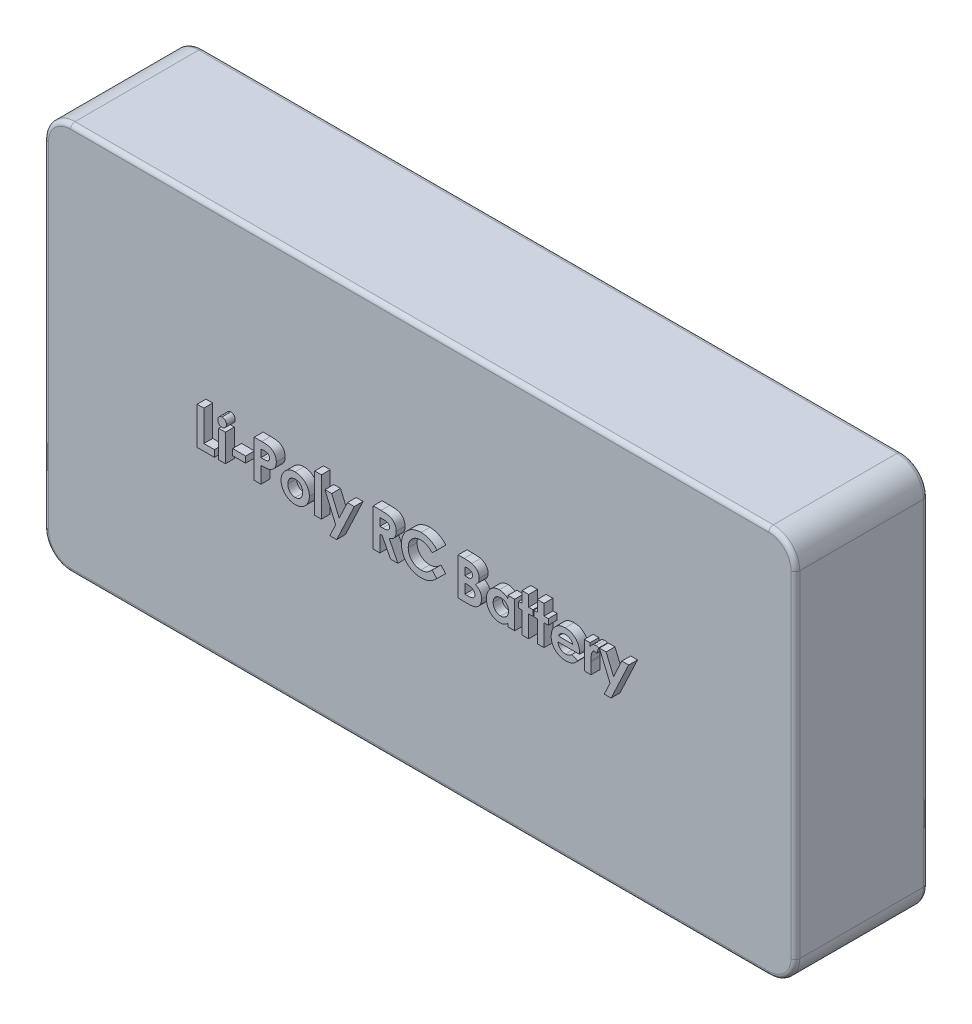
from build123d import *

# Parameters (mm, degrees)
SKETCH1_W           = 85
SKETCH1_H           = 44
BOSS_EXTRUDE1_DEPTH = 15
FILLET1_R           = 3
FILLET2_R           = 0.5
SKETCH2_W           = 0.75982906
SKETCH2_H           = 3.093589743
SKETCH2_W_2         = 1.465384616
SKETCH2_H_2         = 0.705555555
SKETCH2_H_3         = 4.341880342
BOSS_EXTRUDE2_DEPTH = 1


with BuildPart() as part:
    # Sketch1 → Boss-Extrude1 (new body)
    with BuildSketch(Plane.XY):
        with Locations((7.382629108, -9.695618153)):
            Rectangle(SKETCH1_W, SKETCH1_H)
    extrude(amount=BOSS_EXTRUDE1_DEPTH)

    # Fillet1
    fillet1_edges = [part.edges().sort_by_distance(p)[0] for p in [
        (-35.117370892, 12.304381847, 7.5),
        (49.882629108, 12.304381847, 7.5),
        (49.882629108, -31.695618153, 7.5),
        (-35.117370892, -31.695618153, 7.5),
    ]]
    fillet(fillet1_edges, radius=FILLET1_R)

    # Fillet2
    fillet2_edges = [part.edges().sort_by_distance(p)[0] for p in [
        (7.382629108, 12.304381847, 0),
        (7.382629108, 12.304381847, 15),
        (-35.117370892, -9.695618153, 0),
        (49.882629108, -9.695618153, 0),
        (7.382629108, -31.695618153, 0),
        (-34.238691236, 11.42570219, 0),
        (-34.238691236, -30.816938497, 0),
        (49.003949452, -30.816938497, 0),
        (49.003949452, 11.42570219, 0),
        (49.882629108, -9.695618153, 15),
        (-35.117370892, -9.695618153, 15),
        (7.382629108, -31.695618153, 15),
        (-34.238691236, 11.42570219, 15),
        (-34.238691236, -30.816938497, 15),
        (49.003949452, -30.816938497, 15),
        (49.003949452, 11.42570219, 15),
    ]]
    fillet(fillet2_edges, radius=FILLET2_R)

    # Sketch2 → Boss-Extrude2 (add)
    # profile 1 of 17: a face of its own
    with BuildSketch(Plane.XY.offset(15)):
        Polygon((-16.796217046, -6.973647825), (-16.036387986, -6.973647825), (-16.036387986, -10.447152098), (-14.842370892, -10.447152098), (-14.842370892, -11.206981158), (-16.796217046, -11.206981158), align=None)
    # profile 2 of 17: a face of its own
    with BuildSketch(Plane.XY.offset(15)):
        with BuildLine():
            add(Edge.make_bspline(
                [(-13.975690871, -6.810827312), (-13.942942243, -6.812434084), (-13.878637159, -6.815589135), (-13.786511375, -6.846343862), (-13.701958575, -6.894612487), (-13.627211556, -6.960838192), (-13.565043975, -7.039923796), (-13.517545634, -7.128465388), (-13.491086287, -7.22656662), (-13.487411475, -7.294333925), (-13.485533285, -7.328969673)],
                knots=[0, 0, 0, 0, 0.989868614, 1.943702388, 2.910836514, 3.924849579, 4.949916355, 5.946401046, 6.950409252, 8, 8, 8, 8], degree=3))
            add(Edge.make_bspline(
                [(-13.485533285, -7.328969673), (-13.487344277, -7.363350175), (-13.490873079, -7.43034222), (-13.518154612, -7.527111683), (-13.563746535, -7.61561027), (-13.626417634, -7.693521306), (-13.700354298, -7.758680406), (-13.783059554, -7.807825319), (-13.874302506, -7.836869168), (-13.93760977, -7.840287964), (-13.969754706, -7.842023893)],
                knots=[0, 0, 0, 0, 1.05296456, 2.051751585, 3.055639087, 4.085634717, 5.099016424, 6.062201612, 7.016062274, 8, 8, 8, 8], degree=3))
            add(Edge.make_bspline(
                [(-13.969754706, -7.842023893), (-14.002789202, -7.840422866), (-14.067653738, -7.837279185), (-14.160535143, -7.806452498), (-14.246215661, -7.75856402), (-14.320638428, -7.690985221), (-14.383517967, -7.611337654), (-14.428941562, -7.520734738), (-14.457355144, -7.421962691), (-14.460727811, -7.353191706), (-14.462456362, -7.317945368)],
                knots=[0, 0, 0, 0, 0.989065327, 1.942068821, 2.907541208, 3.917690034, 4.939857478, 5.938239964, 6.943311734, 8, 8, 8, 8], degree=3))
            add(Edge.make_bspline(
                [(-14.462456362, -7.317945368), (-14.460575226, -7.284148667), (-14.456880005, -7.217759928), (-14.430262163, -7.121839774), (-14.383852958, -7.034786705), (-14.322133176, -6.957148837), (-14.248042687, -6.892158491), (-14.163540646, -6.845355815), (-14.072034871, -6.815871345), (-14.008137137, -6.812526017), (-13.975690871, -6.810827312)],
                knots=[0, 0, 0, 0, 1.038616768, 2.040212704, 3.031499824, 4.052181184, 5.074969369, 6.039807101, 7.004644834, 8, 8, 8, 8], degree=3))
        make_face()
    # profile 3 of 17: a face of its own
    with BuildSketch(Plane.XY.offset(15)):
        with Locations((-13.973994824, -9.660186287)):
            Rectangle(SKETCH2_W, SKETCH2_H)
    # profile 4 of 17: a face of its own
    with BuildSketch(Plane.XY.offset(15)):
        with Locations((-12.047285422, -9.660186287)):
            Rectangle(SKETCH2_W_2, SKETCH2_H_2)
    # profile 5 of 17: a face of its own
    with BuildSketch(Plane.XY.offset(15)):
        with BuildLine():
            Line((-10.337670037, -6.973647825), (-9.489646533, -6.973647825))
            add(Edge.make_bspline(
                [(-9.489646533, -6.973647825), (-9.434237777, -6.973895846), (-9.327342673, -6.974374332), (-9.173191139, -6.980176602), (-9.0309788, -6.990574623), (-8.900738331, -7.003424933), (-8.782523283, -7.021440567), (-8.676185615, -7.042094081), (-8.58170326, -7.067256073), (-8.498010789, -7.097123008), (-8.422899499, -7.132334958), (-8.351819993, -7.169838198), (-8.286378676, -7.214596992), (-8.223272527, -7.261787427), (-8.166109432, -7.315917588), (-8.111323217, -7.373385035), (-8.061234227, -7.436468877), (-8.015610367, -7.504405503), (-7.974222497, -7.575939735), (-7.938063284, -7.651199453), (-7.908732956, -7.73030375), (-7.884128458, -7.812740909), (-7.864365885, -7.898507339), (-7.851211287, -7.988130509), (-7.842276023, -8.080984639), (-7.841487609, -8.144181218), (-7.841088841, -8.176145154)],
                knots=[0, 0, 0, 0, 1.698747864, 3.27724071, 4.728299578, 6.070144658, 7.288476769, 8.393259625, 9.389771311, 10.283485332, 11.113357557, 11.931608583, 12.74405601, 13.541433047, 14.344816069, 15.154114104, 15.974336324, 16.810834471, 17.661136416, 18.50621059, 19.367396281, 20.244825668, 21.142564693, 22.063065223, 23.020325768, 24, 24, 24, 24], degree=3))
            add(Edge.make_bspline(
                [(-7.841088841, -8.176145154), (-7.841665809, -8.211506096), (-7.842799622, -8.280994692), (-7.853914646, -8.382856448), (-7.872902617, -8.47997241), (-7.897718903, -8.573161574), (-7.932323449, -8.660890773), (-7.971857518, -8.74525325), (-8.020496962, -8.823883743), (-8.076075303, -8.897765822), (-8.136773192, -8.967500185), (-8.204031594, -9.031073384), (-8.276568536, -9.088918795), (-8.353964126, -9.141642642), (-8.436508931, -9.189138569), (-8.524143392, -9.231851326), (-8.617465925, -9.268414826), (-8.682452929, -9.287537241), (-8.715401074, -9.297232227)],
                knots=[0, 0, 0, 0, 1.102006807, 2.165578795, 3.188629044, 4.184801286, 5.166646146, 6.124351954, 7.085497154, 8.042432466, 9.003981491, 9.963833307, 10.922997304, 11.89326795, 12.880200226, 13.889073926, 14.929769137, 16, 16, 16, 16], degree=3))
            add(Edge.make_bspline(
                [(-8.715401074, -9.297232227), (-8.737102617, -9.302631606), (-8.784115148, -9.3143284), (-8.861907975, -9.326203581), (-8.95155604, -9.337122081), (-9.053349234, -9.346505209), (-9.167346243, -9.35288355), (-9.293436688, -9.35786475), (-9.431677712, -9.361486598), (-9.527805053, -9.361615117), (-9.577840977, -9.361682013)],
                knots=[0, 0, 0, 0, 0.618981996, 1.340914327, 2.176866532, 3.120127938, 4.170906482, 5.338178032, 6.614476169, 8, 8, 8, 8], degree=3))
            Line((-9.577840977, -9.361682013), (-9.577840977, -11.206981158))
            Line((-9.577840977, -11.206981158), (-10.337670037, -11.206981158))
            Line((-10.337670037, -11.206981158), (-10.337670037, -6.973647825))
        make_face()
        with BuildLine():
            Line((-9.577840977, -8.601852953), (-9.309017527, -8.601852953))
            add(Edge.make_bspline(
                [(-9.309017527, -8.601852953), (-9.260100856, -8.601542784), (-9.170093454, -8.600972067), (-9.047175129, -8.59271917), (-8.948395598, -8.58011533), (-8.870357934, -8.562038509), (-8.808739807, -8.534604539), (-8.75559803, -8.502868602), (-8.710016971, -8.462739381), (-8.670550483, -8.41688488), (-8.638998216, -8.364195759), (-8.617118361, -8.30552996), (-8.602905638, -8.242120113), (-8.601592961, -8.197991056), (-8.600917901, -8.175297131)],
                knots=[0, 0, 0, 0, 1.8619151, 3.425951444, 4.686033666, 5.651700536, 6.461346321, 7.243864085, 7.999046032, 8.762387399, 9.539336099, 10.322741239, 11.137448474, 12, 12, 12, 12], degree=3))
            add(Edge.make_bspline(
                [(-8.600917901, -8.175297131), (-8.601586017, -8.155469743), (-8.602882325, -8.116999845), (-8.612405351, -8.061478241), (-8.627582315, -8.009720651), (-8.649573153, -7.962267617), (-8.678002099, -7.919199768), (-8.712662737, -7.88053407), (-8.753110304, -7.845442465), (-8.78433819, -7.826867942), (-8.800203424, -7.817431212)],
                knots=[0, 0, 0, 0, 1.102301479, 2.1387299, 3.123554645, 4.094223062, 5.036071848, 5.982632524, 6.975082478, 8, 8, 8, 8], degree=3))
            add(Edge.make_bspline(
                [(-8.800203424, -7.817431212), (-8.813642193, -7.810634841), (-8.842094822, -7.796245531), (-8.890552407, -7.779516906), (-8.946471719, -7.765404468), (-9.010230279, -7.75369128), (-9.081573733, -7.74460063), (-9.160489354, -7.737648557), (-9.247093273, -7.734852858), (-9.307321117, -7.733948193), (-9.338698349, -7.733476885)],
                knots=[0, 0, 0, 0, 0.656809284, 1.390599849, 2.23162475, 3.173112763, 4.218524733, 5.370385145, 6.63003504, 8, 8, 8, 8], degree=3))
            Line((-9.338698349, -7.733476885), (-9.577840977, -7.733476885))
            Line((-9.577840977, -7.733476885), (-9.577840977, -8.601852953))
        make_face(mode=Mode.SUBTRACT)
    # profile 6 of 17: a face of its own
    with BuildSketch(Plane.XY.offset(15)):
        with BuildLine():
            add(Edge.make_bspline(
                [(-5.715941939, -8.05911791), (-5.680018688, -8.059757189), (-5.608874373, -8.061023251), (-5.502913804, -8.071562059), (-5.39880567, -8.088756559), (-5.295951571, -8.111020435), (-5.195306604, -8.142215455), (-5.096342899, -8.179629058), (-4.998175593, -8.222584249), (-4.90324118, -8.273715952), (-4.810853829, -8.329172947), (-4.723265123, -8.390346563), (-4.641202424, -8.456756301), (-4.56314237, -8.5268624), (-4.492722685, -8.603717051), (-4.425443174, -8.683617073), (-4.364938784, -8.769425007), (-4.308920435, -8.859049911), (-4.259047701, -8.951973503), (-4.215742404, -9.047549371), (-4.178157478, -9.144456113), (-4.148729234, -9.243874119), (-4.124365361, -9.34449243), (-4.108990025, -9.447544049), (-4.098059227, -9.551970376), (-4.096833538, -9.622278773), (-4.096217046, -9.657642216)],
                knots=[0, 0, 0, 0, 1.022364134, 2.024744242, 3.027414945, 4.024939316, 5.017584196, 6.023349371, 7.035562955, 8.064994934, 9.090267829, 10.101425541, 11.102933353, 12.093946398, 13.084502048, 14.067315274, 15.065326281, 16.070028806, 17.074376865, 18.064572984, 19.055292013, 20.030201733, 21.013838017, 21.999348303, 22.993720005, 24, 24, 24, 24], degree=3))
            add(Edge.make_bspline(
                [(-4.096217046, -9.657642216), (-4.096867651, -9.693281936), (-4.098161202, -9.76414178), (-4.108594562, -9.869550366), (-4.125854877, -9.973086588), (-4.148204202, -10.075360396), (-4.179282482, -10.1750631), (-4.215594134, -10.273664355), (-4.260168116, -10.369820191), (-4.309447937, -10.464579577), (-4.365826461, -10.555154032), (-4.426278477, -10.641821555), (-4.493276189, -10.722308447), (-4.563132145, -10.799110833), (-4.63915977, -10.869631599), (-4.720145524, -10.935015813), (-4.805388292, -10.996062828), (-4.895501062, -11.051340366), (-4.989329639, -11.099910767), (-5.085291621, -11.143700947), (-5.183948141, -11.180159399), (-5.285095024, -11.209890262), (-5.388793611, -11.232910125), (-5.494814965, -11.248547792), (-5.602930752, -11.259423609), (-5.675774913, -11.260640382), (-5.712549845, -11.261254663)],
                knots=[0, 0, 0, 0, 1.012026251, 2.012137606, 3.004615893, 3.992048833, 4.982446996, 5.968083444, 6.973977695, 7.990229942, 8.999482246, 10.001782172, 10.988562221, 11.971415814, 12.948383116, 13.930088534, 14.925840678, 15.924049238, 16.929462851, 17.924729459, 18.917889337, 19.913673841, 20.916777188, 21.931792057, 22.95587778, 24, 24, 24, 24], degree=3))
            add(Edge.make_bspline(
                [(-5.712549845, -11.261254663), (-5.766322295, -11.259676335), (-5.872308611, -11.256565428), (-6.028401399, -11.235256526), (-6.17835504, -11.198578319), (-6.322413883, -11.147449708), (-6.460765064, -11.081930297), (-6.592201164, -11.000840078), (-6.718029614, -10.905775482), (-6.836070972, -10.797540006), (-6.944212846, -10.678795887), (-7.038687784, -10.552037264), (-7.118904652, -10.419164034), (-7.184791278, -10.280024679), (-7.235642318, -10.1344284), (-7.272365446, -9.98281048), (-7.2937004, -9.824744742), (-7.296784996, -9.71735032), (-7.298353798, -9.662730357)],
                knots=[0, 0, 0, 0, 1.029999031, 2.030143771, 3.011211297, 3.982305373, 4.953580601, 5.938004764, 6.935448627, 7.970290061, 9.001484052, 10.007591832, 10.993831261, 11.969999897, 12.951306496, 13.942897864, 14.953773953, 16, 16, 16, 16], degree=3))
            add(Edge.make_bspline(
                [(-7.298353798, -9.662730357), (-7.296730288, -9.60440821), (-7.29353931, -9.489777199), (-7.268201546, -9.321840154), (-7.227739871, -9.161048393), (-7.169659685, -9.007851701), (-7.095467355, -8.861967527), (-7.004895334, -8.723703557), (-6.897496011, -8.593028472), (-6.815249635, -8.513991701), (-6.773427249, -8.473801404)],
                knots=[0, 0, 0, 0, 1.043912699, 2.05178951, 3.033892, 4.007821512, 4.978932272, 5.95884105, 6.962068106, 8, 8, 8, 8], degree=3))
            add(Edge.make_bspline(
                [(-6.773427249, -8.473801404), (-6.73505103, -8.440488168), (-6.659342693, -8.37476805), (-6.536341564, -8.291412854), (-6.410402287, -8.219419396), (-6.280015426, -8.160227383), (-6.144817497, -8.11559756), (-6.005501311, -8.083111042), (-5.862095838, -8.06315687), (-5.764907484, -8.060471072), (-5.715941939, -8.05911791)],
                knots=[0, 0, 0, 0, 1.048115528, 2.067714963, 3.060638214, 4.039924844, 5.017819947, 5.994373833, 6.98952318, 8, 8, 8, 8], degree=3))
        make_face()
        with BuildLine():
            add(Edge.make_bspline(
                [(-5.698981469, -8.764673466), (-5.728399965, -8.765651239), (-5.786310591, -8.767575997), (-5.871556554, -8.777905656), (-5.952183084, -8.799077179), (-6.029791574, -8.826001562), (-6.103009121, -8.862009131), (-6.173840894, -8.904146284), (-6.238603796, -8.956875746), (-6.300431912, -9.014716109), (-6.356558059, -9.078946279), (-6.404382866, -9.148925001), (-6.447115391, -9.221975037), (-6.479517297, -9.300770838), (-6.506332973, -9.383158687), (-6.5244815, -9.470469721), (-6.537111608, -9.561728628), (-6.538049214, -9.624241604), (-6.538524738, -9.655946169)],
                knots=[0, 0, 0, 0, 1.030650113, 2.02884584, 2.99876339, 3.944280128, 4.900564847, 5.851248946, 6.823638398, 7.81794922, 8.81432732, 9.802856497, 10.78262424, 11.771747962, 12.779760563, 13.812642396, 14.89064281, 16, 16, 16, 16], degree=3))
            add(Edge.make_bspline(
                [(-6.538524738, -9.655946169), (-6.537968311, -9.688768796), (-6.53688088, -9.752914317), (-6.525620308, -9.846575404), (-6.507051253, -9.935459155), (-6.480670445, -10.019428263), (-6.447492125, -10.099085449), (-6.406786174, -10.173983782), (-6.358122986, -10.243672927), (-6.302950742, -10.308067066), (-6.242539491, -10.36651834), (-6.176345566, -10.416679035), (-6.107140917, -10.460262022), (-6.033330696, -10.495265888), (-5.955963217, -10.522291712), (-5.87480881, -10.542189917), (-5.789441008, -10.552910105), (-5.731233658, -10.554756656), (-5.701525539, -10.555699107)],
                knots=[0, 0, 0, 0, 1.141730614, 2.231293227, 3.276944405, 4.297399982, 5.28939179, 6.275415646, 7.257752684, 8.24146775, 9.222424823, 10.176631434, 11.126518621, 12.063689483, 13.012557477, 13.974037417, 14.965980454, 16, 16, 16, 16], degree=3))
            add(Edge.make_bspline(
                [(-5.701525539, -10.555699107), (-5.671802562, -10.554863196), (-5.613528272, -10.553224325), (-5.528060221, -10.540951767), (-5.44649138, -10.52163718), (-5.368463123, -10.494378754), (-5.294606315, -10.45862565), (-5.224638227, -10.414834156), (-5.15794334, -10.36397577), (-5.096721365, -10.304421632), (-5.040049353, -10.23982667), (-4.990351388, -10.169769642), (-4.948821894, -10.09487129), (-4.914760273, -10.015602876), (-4.88832775, -9.932073355), (-4.87006611, -9.843972256), (-4.857429249, -9.751572613), (-4.856512847, -9.688215313), (-4.856046106, -9.655946169)],
                knots=[0, 0, 0, 0, 1.031504075, 2.022346795, 2.991027682, 3.937587355, 4.885570121, 5.833146507, 6.798790848, 7.791235734, 8.792807298, 9.778388351, 10.766749885, 11.760164525, 12.768777521, 13.802286646, 14.880660483, 16, 16, 16, 16], degree=3))
            add(Edge.make_bspline(
                [(-4.856046106, -9.655946169), (-4.856609612, -9.623688303), (-4.857715393, -9.560387905), (-4.868976768, -9.467863293), (-4.887363591, -9.380046962), (-4.914084653, -9.297313881), (-4.947065766, -9.218720196), (-4.987799853, -9.1446682), (-5.036703032, -9.075522617), (-5.092143484, -9.01162631), (-5.153460337, -8.953995241), (-5.218504977, -8.902602317), (-5.288764774, -8.860096422), (-5.362921612, -8.82505639), (-5.441172787, -8.798098087), (-5.52343045, -8.778087114), (-5.609946695, -8.767519469), (-5.668993037, -8.765632048), (-5.698981469, -8.764673466)],
                knots=[0, 0, 0, 0, 1.123894411, 2.205445421, 3.243160173, 4.246488011, 5.231014757, 6.210004299, 7.185865357, 8.177612767, 9.153374344, 10.115157457, 11.061423229, 12.009021698, 12.96873347, 13.94135618, 14.954456845, 16, 16, 16, 16], degree=3))
        make_face(mode=Mode.SUBTRACT)
    # profile 7 of 17: a face of its own
    with BuildSketch(Plane.XY.offset(15)):
        with Locations((-3.119293969, -9.036040987)):
            Rectangle(SKETCH2_W, SKETCH2_H_3)
    # profile 8 of 17: a face of its own
    with BuildSketch(Plane.XY.offset(15)):
        Polygon((-2.334024204, -8.113391415), (-1.573347121, -8.113391415), (-0.72871571, -10.103702579), (0.205806191, -8.113391415), (0.978355604, -8.113391415), (-1.010259514, -12.346724748), (-1.782808926, -12.346724748), (-1.128982804, -10.955118178), align=None)
    # profile 9 of 17: a face of its own
    with BuildSketch(Plane.XY.offset(15)):
        with BuildLine():
            Line((3.122159023, -6.973647825), (4.007495561, -6.973647825))
            add(Edge.make_bspline(
                [(4.007495561, -6.973647825), (4.066016037, -6.973855539), (4.178567396, -6.974255032), (4.340860308, -6.980557969), (4.489948667, -6.989329023), (4.626053211, -7.002713885), (4.749115713, -7.020460593), (4.85925951, -7.041381026), (4.956481383, -7.065224344), (5.041601263, -7.094935), (5.118417746, -7.128448169), (5.190021387, -7.166955415), (5.25799187, -7.210027948), (5.321874886, -7.258799122), (5.382225592, -7.312391555), (5.439157844, -7.370859195), (5.491867136, -7.434697822), (5.540027091, -7.503504057), (5.583921013, -7.575886639), (5.622714033, -7.651944949), (5.654260583, -7.73173188), (5.68213534, -7.81409434), (5.702212625, -7.900209715), (5.716176083, -7.989239658), (5.726399581, -8.081497563), (5.726987383, -8.144173488), (5.727287228, -8.176145154)],
                knots=[0, 0, 0, 0, 1.749336639, 3.364467119, 4.854658419, 6.213483162, 7.451590619, 8.570285859, 9.5643256, 10.440900261, 11.26203566, 12.067320669, 12.869050712, 13.665104639, 14.467235401, 15.27997916, 16.102287765, 16.939272006, 17.78853747, 18.631303466, 19.488103222, 20.351255419, 21.228522269, 22.127379805, 23.044756219, 24, 24, 24, 24], degree=3))
            add(Edge.make_bspline(
                [(5.727287228, -8.176145154), (5.72650834, -8.209516229), (5.724981083, -8.274950824), (5.716754449, -8.371068908), (5.701718744, -8.463027967), (5.678944983, -8.550558757), (5.652769502, -8.6347507), (5.617962826, -8.714050404), (5.578680053, -8.789611166), (5.532025051, -8.860364151), (5.480823466, -8.927880924), (5.421277099, -8.989574668), (5.35724364, -9.048761187), (5.285123537, -9.101733239), (5.208095909, -9.152072602), (5.124630299, -9.197693471), (5.035271432, -9.23974265), (4.972447723, -9.263192176), (4.940321416, -9.275183616)],
                knots=[0, 0, 0, 0, 1.099860209, 2.156625411, 3.176576793, 4.16617041, 5.135385252, 6.078461593, 7.016046972, 7.938469504, 8.868247731, 9.803980173, 10.76021508, 11.73834243, 12.748633912, 13.790971185, 14.870363756, 16, 16, 16, 16], degree=3))
            Line((4.940321416, -9.275183616), (5.917244493, -11.206981158))
            Line((5.917244493, -11.206981158), (5.072613082, -11.206981158))
            Line((5.072613082, -11.206981158), (4.139787228, -9.361682013))
            Line((4.139787228, -9.361682013), (3.881988082, -9.361682013))
            Line((3.881988082, -9.361682013), (3.881988082, -11.206981158))
            Line((3.881988082, -11.206981158), (3.122159023, -11.206981158))
            Line((3.122159023, -11.206981158), (3.122159023, -6.973647825))
        make_face()
        with BuildLine():
            Line((3.881988082, -8.601852953), (4.177948285, -8.601852953))
            add(Edge.make_bspline(
                [(4.177948285, -8.601852953), (4.21413188, -8.601445429), (4.28341569, -8.600665108), (4.383054908, -8.597045657), (4.47355108, -8.588324567), (4.555292829, -8.577305797), (4.62869147, -8.564583035), (4.693092314, -8.546350544), (4.749487679, -8.52681397), (4.797209279, -8.502535075), (4.837981517, -8.474924705), (4.873185735, -8.443558639), (4.902304671, -8.407256412), (4.926271041, -8.367004561), (4.944914271, -8.322447069), (4.958522401, -8.274073076), (4.966127333, -8.22133154), (4.967002306, -8.184932699), (4.967458168, -8.165968872)],
                knots=[0, 0, 0, 0, 1.688639943, 3.233382647, 4.650958383, 5.928841754, 7.082724185, 8.122798841, 9.049171256, 9.863274652, 10.613301712, 11.341792392, 12.054588806, 12.776240173, 13.521029143, 14.301969904, 15.115324896, 16, 16, 16, 16], degree=3))
            add(Edge.make_bspline(
                [(4.967458168, -8.165968872), (4.966596319, -8.14353328), (4.964903377, -8.099462718), (4.948104135, -8.036016562), (4.92136337, -7.977292803), (4.884709105, -7.923556771), (4.838547823, -7.876448056), (4.785574111, -7.834921348), (4.724644667, -7.802085134), (4.668228587, -7.780426718), (4.616903141, -7.767468264), (4.570583545, -7.757811738), (4.516945174, -7.750967881), (4.455947534, -7.743708753), (4.38774611, -7.739001576), (4.311969164, -7.735566275), (4.228834325, -7.734160724), (4.170881447, -7.733711395), (4.140635251, -7.733476885)],
                knots=[0, 0, 0, 0, 1.020303359, 2.004196876, 2.966617323, 3.9489082, 4.950758222, 5.960522915, 7.003732012, 8.091992268, 8.70421221, 9.413913587, 10.24622431, 11.166358409, 12.212345909, 13.359657661, 14.621978493, 16, 16, 16, 16], degree=3))
            Line((4.140635251, -7.733476885), (3.881988082, -7.733476885))
            Line((3.881988082, -7.733476885), (3.881988082, -8.601852953))
        make_face(mode=Mode.SUBTRACT)
    # profile 10 of 17: a face of its own
    with BuildSketch(Plane.XY.offset(15)):
        with BuildLine():
            Line((10.340535091, -7.70803618), (9.783383649, -8.24059494))
            add(Edge.make_bspline(
                [(9.783383649, -8.24059494), (9.736121524, -8.191725825), (9.643803789, -8.096269131), (9.495045175, -7.969892882), (9.340341633, -7.864575377), (9.182702612, -7.775877645), (9.019292642, -7.708771489), (8.852001188, -7.659870103), (8.679760044, -7.630056776), (8.563193863, -7.626645604), (8.504564204, -7.624929876)],
                knots=[0, 0, 0, 0, 1.115251505, 2.178435587, 3.19620269, 4.182487026, 5.141301733, 6.088180966, 7.038406374, 8, 8, 8, 8], degree=3))
            add(Edge.make_bspline(
                [(8.504564204, -7.624929876), (8.455601315, -7.626285361), (8.358978446, -7.628960262), (8.217110756, -7.648569921), (8.081406978, -7.681916999), (7.951402578, -7.727875451), (7.827480098, -7.787343247), (7.70937972, -7.860274363), (7.597392615, -7.946010125), (7.492998068, -8.044106935), (7.397501606, -8.15128507), (7.313124401, -8.265643885), (7.242444956, -8.38692139), (7.184439486, -8.513889375), (7.139255467, -8.647135511), (7.106988401, -8.786570092), (7.088325992, -8.932359173), (7.085540502, -9.031465504), (7.084124834, -9.081834257)],
                knots=[0, 0, 0, 0, 1.035432265, 2.043311493, 3.022114605, 3.98653278, 4.95457646, 5.923598177, 6.917315552, 7.932509744, 8.948865224, 9.949768934, 10.933144597, 11.912367597, 12.897413939, 13.903909035, 14.934704909, 16, 16, 16, 16], degree=3))
            add(Edge.make_bspline(
                [(7.084124834, -9.081834257), (7.084532814, -9.117186572), (7.085336949, -9.186866711), (7.094139635, -9.289942975), (7.108314036, -9.38995132), (7.128827905, -9.48674026), (7.154480699, -9.580393672), (7.184577269, -9.6717195), (7.222332972, -9.759455827), (7.264242373, -9.844621652), (7.312982523, -9.924893121), (7.365533396, -10.001438628), (7.422516238, -10.073882955), (7.48430013, -10.141929948), (7.551754604, -10.204516184), (7.623136211, -10.263523707), (7.699649059, -10.317475357), (7.779703784, -10.367725111), (7.863991957, -10.411377501), (7.950226644, -10.450918132), (8.039715337, -10.483031003), (8.131368458, -10.508916907), (8.224858469, -10.530929002), (8.321099792, -10.544482526), (8.419258133, -10.554746451), (8.485596696, -10.555380188), (8.518980604, -10.555699107)],
                knots=[0, 0, 0, 0, 1.103660481, 2.175337485, 3.227646561, 4.255952547, 5.262355991, 6.258840057, 7.255597736, 8.242457506, 9.22035537, 10.185017736, 11.140346927, 12.096287581, 13.051739095, 14.01125915, 14.986044842, 15.97314143, 16.960198552, 17.947847494, 18.933482797, 19.925264591, 20.920966487, 21.929612487, 22.958107872, 24, 24, 24, 24], degree=3))
            add(Edge.make_bspline(
                [(8.518980604, -10.555699107), (8.575605449, -10.554061216), (8.686858545, -10.550843186), (8.850138461, -10.525678648), (9.005727953, -10.484284406), (9.130043214, -10.435400212), (9.227440936, -10.387126436), (9.301588383, -10.34247557), (9.378262622, -10.292528674), (9.456190159, -10.235400698), (9.536247525, -10.171777201), (9.617021523, -10.10026471), (9.700579982, -10.023218027), (9.7553183, -9.968228296), (9.783383649, -9.940034043)],
                knots=[0, 0, 0, 0, 1.404581149, 2.759636711, 4.088442092, 5.392261763, 6.066678138, 6.783632037, 7.538459478, 8.336747902, 9.180226004, 10.074962426, 11.012997595, 12, 12, 12, 12], degree=3))
            Line((9.783383649, -9.940034043), (10.323574621, -10.507361767))
            add(Edge.make_bspline(
                [(10.323574621, -10.507361767), (10.285602103, -10.544023041), (10.211487869, -10.615578007), (10.099688605, -10.717179382), (9.988030044, -10.808479512), (9.879209626, -10.892792191), (9.771444757, -10.967661187), (9.664746867, -11.033161272), (9.560323822, -11.090949038), (9.456007244, -11.140049922), (9.351148021, -11.181741673), (9.243260204, -11.217635533), (9.132013969, -11.248000448), (9.016729874, -11.272500947), (8.89848322, -11.292147039), (8.776167375, -11.305408037), (8.650557882, -11.314322965), (8.565355017, -11.315124046), (8.522372698, -11.315528167)],
                knots=[0, 0, 0, 0, 1.244526981, 2.429050516, 3.560637417, 4.644440555, 5.67424972, 6.652764056, 7.595344123, 8.486817594, 9.369275933, 10.254498637, 11.166417451, 12.086725134, 13.032340136, 13.991389299, 14.986715468, 16, 16, 16, 16], degree=3))
            add(Edge.make_bspline(
                [(8.522372698, -11.315528167), (8.443419502, -11.313515492), (8.288930045, -11.309577248), (8.062529774, -11.280397524), (7.847455594, -11.23147823), (7.643184269, -11.162292856), (7.449780753, -11.073911783), (7.267294526, -10.965560737), (7.096019713, -10.83752759), (6.937339878, -10.691313016), (6.793806416, -10.529831293), (6.666939458, -10.356444223), (6.561995105, -10.170299673), (6.474857548, -9.974147592), (6.406717124, -9.767092862), (6.358757817, -9.548911513), (6.329181662, -9.319814212), (6.325945989, -9.163335475), (6.324295775, -9.083530304)],
                knots=[0, 0, 0, 0, 1.078019885, 2.10938526, 3.111377082, 4.085535484, 5.04941344, 6.010039228, 6.978205633, 7.964457913, 8.951525778, 9.924444315, 10.892603023, 11.863865945, 12.85144698, 13.863884204, 14.910567087, 16, 16, 16, 16], degree=3))
            add(Edge.make_bspline(
                [(6.324295775, -9.083530304), (6.324993075, -9.031482052), (6.326374955, -8.928335138), (6.340898635, -8.776391377), (6.36114549, -8.628273388), (6.393265285, -8.485519128), (6.43198253, -8.346205433), (6.48013251, -8.21184648), (6.537638324, -8.082056108), (6.602646424, -7.95661704), (6.676189438, -7.836351036), (6.758345057, -7.722291371), (6.846998277, -7.613557526), (6.944279288, -7.511592056), (7.048774472, -7.415499685), (7.160955612, -7.325801156), (7.280147994, -7.241210091), (7.406674227, -7.163907888), (7.538076245, -7.093983937), (7.672696721, -7.032308025), (7.810204909, -6.980761166), (7.950019413, -6.938004948), (8.092730945, -6.906090454), (8.237320868, -6.881932212), (8.385019469, -6.8684276), (8.484186284, -6.866216809), (8.534245027, -6.865100816)],
                knots=[0, 0, 0, 0, 1.071919942, 2.124283339, 3.142214191, 4.149696895, 5.136002878, 6.119640489, 7.086990633, 8.058538607, 9.028339693, 9.988281803, 10.952401235, 11.916291999, 12.888973767, 13.874849856, 14.873389453, 15.898127285, 16.927174885, 17.938320013, 18.946391617, 19.950418109, 20.947802303, 21.956882652, 22.968648068, 24, 24, 24, 24], degree=3))
            add(Edge.make_bspline(
                [(8.534245027, -6.865100816), (8.576950267, -6.865740531), (8.661916732, -6.867013309), (8.788446057, -6.877623301), (8.913963459, -6.894286186), (9.038019549, -6.919426931), (9.161501701, -6.949272172), (9.282787222, -6.988350398), (9.403789457, -7.031910446), (9.522610665, -7.083977588), (9.639416703, -7.140813577), (9.751471207, -7.205296071), (9.860655559, -7.273456888), (9.964550302, -7.349330086), (10.065101607, -7.430163601), (10.161783683, -7.516334568), (10.253748088, -7.609279709), (10.311459842, -7.674950938), (10.340535091, -7.70803618)],
                knots=[0, 0, 0, 0, 0.996412454, 1.982464992, 2.961075852, 3.949442424, 4.934965278, 5.923860011, 6.921385422, 7.934793307, 8.949617135, 9.951082467, 10.950285876, 11.951772932, 12.951063433, 13.960125323, 14.972308753, 16, 16, 16, 16], degree=3))
        make_face()
    # profile 11 of 17: a face of its own
    with BuildSketch(Plane.XY.offset(15)):
        with BuildLine():
            Line((12.728569279, -11.206981158), (12.728569279, -6.973647825))
            Line((12.728569279, -6.973647825), (13.406988082, -6.973647825))
            add(Edge.make_bspline(
                [(13.406988082, -6.973647825), (13.454481641, -6.973642405), (13.546380775, -6.973631917), (13.678967243, -6.978287918), (13.801929995, -6.984310978), (13.914877715, -6.991049381), (14.018002649, -7.002660995), (14.111147978, -7.014898369), (14.194499808, -7.029655887), (14.246031714, -7.042893838), (14.27027601, -7.049121917)],
                knots=[0, 0, 0, 0, 1.311965854, 2.538629056, 3.664479157, 4.713267157, 5.663616078, 6.530575999, 7.308677837, 8, 8, 8, 8], degree=3))
            add(Edge.make_bspline(
                [(14.27027601, -7.049121917), (14.302111231, -7.057906733), (14.364582155, -7.075145363), (14.454060454, -7.109959522), (14.538943101, -7.148657927), (14.619126459, -7.19280557), (14.694118169, -7.242935436), (14.763633237, -7.299445371), (14.82917093, -7.360067069), (14.888404156, -7.426490038), (14.941941233, -7.49667821), (14.988455353, -7.570613192), (15.028870163, -7.647164471), (15.061212596, -7.727295393), (15.085582012, -7.810636934), (15.103405701, -7.896833213), (15.114957865, -7.986156976), (15.116049393, -8.046926852), (15.116603467, -8.077774428)],
                knots=[0, 0, 0, 0, 1.099996261, 2.158545794, 3.195537121, 4.207578794, 5.205712374, 6.197378256, 7.190519799, 8.17788031, 9.159561366, 10.129234751, 11.085776129, 12.040971148, 13.00380137, 13.975669004, 14.972423361, 16, 16, 16, 16], degree=3))
            add(Edge.make_bspline(
                [(15.116603467, -8.077774428), (15.115154729, -8.117405466), (15.112303065, -8.195414295), (15.094086447, -8.309995152), (15.059927448, -8.418290531), (15.015231229, -8.522296274), (14.954458344, -8.621624441), (14.877288535, -8.716227802), (14.784971699, -8.809019338), (14.714159589, -8.864641605), (14.677327292, -8.893573039)],
                knots=[0, 0, 0, 0, 0.986156485, 1.941127874, 2.875419072, 3.804401753, 4.751181392, 5.761612777, 6.835722519, 8, 8, 8, 8], degree=3))
            add(Edge.make_bspline(
                [(14.677327292, -8.893573039), (14.707174419, -8.908809738), (14.765696377, -8.93868469), (14.848780366, -8.987790194), (14.925707069, -9.040020125), (14.996821405, -9.094323595), (15.060631667, -9.153002609), (15.119772689, -9.212676001), (15.17132676, -9.276762807), (15.217427964, -9.342978852), (15.257498382, -9.412282952), (15.292395297, -9.484558068), (15.321871469, -9.560051107), (15.346832654, -9.638377872), (15.365448712, -9.719807769), (15.377586778, -9.804369921), (15.38688044, -9.891775928), (15.3876034, -9.951314718), (15.387970988, -9.981587195)],
                knots=[0, 0, 0, 0, 1.164658916, 2.283573913, 3.35186032, 4.395461096, 5.390182219, 6.362969632, 7.312859996, 8.245001507, 9.165155236, 10.092416118, 11.032087915, 11.979892451, 12.947605196, 13.931445124, 14.948243989, 16, 16, 16, 16], degree=3))
            add(Edge.make_bspline(
                [(15.387970988, -9.981587195), (15.385585584, -10.039405895), (15.380877999, -10.153510867), (15.346458434, -10.321043173), (15.286785845, -10.479878994), (15.206657862, -10.629387049), (15.107924771, -10.765239324), (14.99441003, -10.884244739), (14.867256472, -10.98498018), (14.749941945, -11.052968788), (14.648474119, -11.098595501), (14.564430214, -11.126804813), (14.474168841, -11.152937877), (14.37603663, -11.171289054), (14.271812582, -11.188086069), (14.160480508, -11.198456894), (14.042248484, -11.205484946), (13.961041619, -11.206472338), (13.919194279, -11.206981158)],
                knots=[0, 0, 0, 0, 1.284142165, 2.534249414, 3.780121997, 5.041676246, 6.291546858, 7.49970053, 8.684500223, 9.883330709, 10.50184324, 11.153274765, 11.851151195, 12.587658647, 13.369265475, 14.195992086, 15.070362669, 16, 16, 16, 16], degree=3))
            Line((13.919194279, -11.206981158), (12.728569279, -11.206981158))
        make_face()
        with BuildLine():
            Line((13.488398339, -7.733476885), (13.488398339, -8.656126457))
            Line((13.488398339, -8.656126457), (13.690227933, -8.656126457))
            add(Edge.make_bspline(
                [(13.690227933, -8.656126457), (13.717658388, -8.655887254), (13.770611222, -8.655425485), (13.847095973, -8.649478064), (13.91821444, -8.639331394), (13.983696885, -8.625174237), (14.044153302, -8.607196712), (14.099197477, -8.585565878), (14.148587392, -8.559173909), (14.205967049, -8.519861906), (14.266621484, -8.462012534), (14.320014901, -8.378437131), (14.351463267, -8.282325735), (14.354965767, -8.214540537), (14.356774407, -8.179537248)],
                knots=[0, 0, 0, 0, 1.065314748, 2.056525647, 2.977365736, 3.853934255, 4.656397591, 5.425096493, 6.14721249, 6.826394842, 8.123232004, 9.372140726, 10.643011755, 12, 12, 12, 12], degree=3))
            add(Edge.make_bspline(
                [(14.356774407, -8.179537248), (14.355327164, -8.146750852), (14.352528978, -8.083359674), (14.320864517, -7.994352813), (14.271683348, -7.915474518), (14.213618066, -7.861488776), (14.15893832, -7.824618106), (14.112118166, -7.80034034), (14.060729531, -7.778607132), (14.003777586, -7.761989391), (13.941587559, -7.749520024), (13.874461541, -7.740362766), (13.802283715, -7.734129948), (13.752430338, -7.733699242), (13.726692943, -7.733476885)],
                knots=[0, 0, 0, 0, 1.347982417, 2.606269829, 3.849316587, 5.153353503, 5.842674298, 6.568177932, 7.326619318, 8.142485038, 9.012069166, 9.942760135, 10.937925643, 12, 12, 12, 12], degree=3))
            Line((13.726692943, -7.733476885), (13.488398339, -7.733476885))
        make_face(mode=Mode.SUBTRACT)
        with BuildLine():
            Line((13.488398339, -9.361682013), (13.488398339, -10.447152098))
            Line((13.488398339, -10.447152098), (13.707188403, -10.447152098))
            add(Edge.make_bspline(
                [(13.707188403, -10.447152098), (13.750443477, -10.446904984), (13.833606755, -10.446429875), (13.952738003, -10.440689432), (14.06105809, -10.430343295), (14.15828001, -10.417426976), (14.244552674, -10.399927384), (14.319584463, -10.377678895), (14.384404338, -10.353201683), (14.438623637, -10.322969419), (14.482917699, -10.287786562), (14.522888445, -10.251828836), (14.555478101, -10.210348202), (14.581263645, -10.165125309), (14.603580988, -10.117283525), (14.617041233, -10.064954648), (14.627289392, -10.009689578), (14.627853375, -9.971463924), (14.628141928, -9.951906372)],
                knots=[0, 0, 0, 0, 1.753078804, 3.370512758, 4.83203934, 6.162291463, 7.344201807, 8.395507345, 9.331626367, 10.147333109, 10.898971645, 11.62040215, 12.321813352, 13.025280112, 13.727906689, 14.453419512, 15.208716525, 16, 16, 16, 16], degree=3))
            add(Edge.make_bspline(
                [(14.628141928, -9.951906372), (14.627505586, -9.929542004), (14.626266161, -9.885982231), (14.616143765, -9.822314974), (14.597748065, -9.762877365), (14.574577783, -9.706149505), (14.542335105, -9.654162448), (14.504015784, -9.60511712), (14.457716262, -9.560674346), (14.405649748, -9.518146063), (14.344919315, -9.480910246), (14.275496469, -9.448601579), (14.197004068, -9.421618571), (14.109198973, -9.400134682), (14.012466115, -9.381901602), (13.90609945, -9.371014441), (13.790984837, -9.362917181), (13.711162491, -9.362103091), (13.669875369, -9.361682013)],
                knots=[0, 0, 0, 0, 0.845221588, 1.646264278, 2.427170338, 3.19324141, 3.95557735, 4.731569926, 5.540061037, 6.376114724, 7.268642756, 8.224665384, 9.265483498, 10.400594375, 11.639216012, 12.983232105, 14.439614077, 16, 16, 16, 16], degree=3))
            Line((13.669875369, -9.361682013), (13.488398339, -9.361682013))
        make_face(mode=Mode.SUBTRACT)
    # profile 12 of 17: a face of its own
    with BuildSketch(Plane.XY.offset(15)):
        with BuildLine():
            Line((18.373013723, -8.113391415), (19.132842783, -8.113391415))
            Line((19.132842783, -8.113391415), (19.132842783, -11.206981158))
            Line((19.132842783, -11.206981158), (18.373013723, -11.206981158))
            Line((18.373013723, -11.206981158), (18.373013723, -10.869467804))
            add(Edge.make_bspline(
                [(18.373013723, -10.869467804), (18.335364473, -10.902320993), (18.262294714, -10.966082546), (18.147160418, -11.048814783), (18.031689686, -11.117058185), (17.915327678, -11.171410334), (17.796285959, -11.211543801), (17.673707476, -11.240601369), (17.545826969, -11.257737328), (17.458895562, -11.260070005), (17.414747164, -11.261254663)],
                knots=[0, 0, 0, 0, 1.129196829, 2.191548051, 3.199897424, 4.157751732, 5.089409408, 6.034969131, 7.002052659, 8, 8, 8, 8], degree=3))
            add(Edge.make_bspline(
                [(17.414747164, -11.261254663), (17.365188623, -11.26013975), (17.26725814, -11.257936621), (17.123556026, -11.234745127), (16.98479735, -11.199245377), (16.851094743, -11.149008794), (16.722691466, -11.08391203), (16.598604844, -11.005653552), (16.480962101, -10.911486019), (16.368783899, -10.80548382), (16.266074211, -10.688880646), (16.176284432, -10.563294935), (16.100598322, -10.430507841), (16.038592741, -10.290959616), (15.989817345, -10.14475268), (15.955047467, -9.991423308), (15.934533199, -9.83091674), (15.93199411, -9.721585952), (15.930706031, -9.666122451)],
                knots=[0, 0, 0, 0, 0.980476535, 1.937477201, 2.874147792, 3.812856188, 4.758993464, 5.720109578, 6.712210464, 7.737600662, 8.772720504, 9.783789959, 10.789002326, 11.793715968, 12.802552247, 13.835794126, 14.902098527, 16, 16, 16, 16], degree=3))
            add(Edge.make_bspline(
                [(15.930706031, -9.666122451), (15.932057875, -9.608689923), (15.934709668, -9.496029621), (15.954107373, -9.330705984), (15.988235617, -9.173574823), (16.034771929, -9.02441849), (16.094632814, -8.883211215), (16.167539373, -8.749721656), (16.254483431, -8.624298733), (16.354671044, -8.509077232), (16.462849059, -8.403471162), (16.578580411, -8.311532703), (16.700055315, -8.233426704), (16.827402859, -8.169661898), (16.960604856, -8.120387683), (17.099135429, -8.084364209), (17.243609554, -8.062748859), (17.342026499, -8.060338278), (17.391850529, -8.05911791)],
                knots=[0, 0, 0, 0, 1.136281865, 2.228943489, 3.287578264, 4.313574083, 5.316051562, 6.317280042, 7.318008486, 8.329309503, 9.333984563, 10.305318864, 11.248632312, 12.186624717, 13.117503092, 14.05354244, 15.014596925, 16, 16, 16, 16], degree=3))
            add(Edge.make_bspline(
                [(17.391850529, -8.05911791), (17.438003725, -8.060076753), (17.529324264, -8.061973956), (17.663552298, -8.082573953), (17.793734132, -8.113729986), (17.919159616, -8.158121725), (18.040857533, -8.214175326), (18.156734602, -8.284414666), (18.269325737, -8.365887617), (18.338024032, -8.429519718), (18.373013723, -8.461929075)],
                knots=[0, 0, 0, 0, 1.017011718, 2.012299608, 2.98747302, 3.965332399, 4.941441765, 5.936729654, 6.94912688, 8, 8, 8, 8], degree=3))
            Line((18.373013723, -8.461929075), (18.373013723, -8.113391415))
        make_face()
        with BuildLine():
            add(Edge.make_bspline(
                [(17.551278948, -8.764673466), (17.521002, -8.765602467), (17.461661158, -8.767423249), (17.37439233, -8.778375379), (17.290989509, -8.79767352), (17.212047519, -8.826182379), (17.136389834, -8.860910323), (17.065165327, -8.904406501), (16.997786161, -8.95581806), (16.934648601, -9.013900325), (16.877089411, -9.077743354), (16.827470031, -9.147409932), (16.785301573, -9.221022939), (16.749638018, -9.298803705), (16.724111004, -9.381672616), (16.703893619, -9.468550867), (16.693402105, -9.560148209), (16.691500325, -9.622568963), (16.690535091, -9.654250122)],
                knots=[0, 0, 0, 0, 1.04836806, 2.054732945, 3.03993516, 4.00574415, 4.955904794, 5.917688631, 6.888591924, 7.88601754, 8.884115178, 9.859153345, 10.841239365, 11.818093293, 12.814750328, 13.83810466, 14.90274714, 16, 16, 16, 16], degree=3))
            add(Edge.make_bspline(
                [(16.690535091, -9.654250122), (16.69148558, -9.686218648), (16.693358509, -9.749212257), (16.704063257, -9.841582255), (16.723553136, -9.929729593), (16.751988136, -10.012941661), (16.786713866, -10.092341263), (16.82898289, -10.167561963), (16.880902981, -10.237273766), (16.938512627, -10.303126286), (17.002945445, -10.361930031), (17.07070587, -10.414142357), (17.142719454, -10.457828378), (17.218204903, -10.493135695), (17.296908127, -10.521908192), (17.379815828, -10.540963794), (17.46611582, -10.553145681), (17.524948803, -10.554842088), (17.554671042, -10.555699107)],
                knots=[0, 0, 0, 0, 1.099136573, 2.165835871, 3.191374663, 4.196217796, 5.183857741, 6.167377911, 7.154730987, 8.166690795, 9.170734848, 10.148332609, 11.103258353, 12.059567475, 13.009337315, 13.978056681, 14.978520572, 16, 16, 16, 16], degree=3))
            add(Edge.make_bspline(
                [(17.554671042, -10.555699107), (17.585511934, -10.554764898), (17.645976847, -10.552933339), (17.734669422, -10.542081159), (17.819192642, -10.52271226), (17.899194843, -10.494040181), (17.975897985, -10.459561515), (18.048609889, -10.416915286), (18.116541522, -10.365621703), (18.180036927, -10.307014372), (18.238218226, -10.242650026), (18.288523803, -10.172069882), (18.332341801, -10.097531287), (18.366802641, -10.017271876), (18.39416938, -9.932695815), (18.413804385, -9.843278207), (18.424484688, -9.748922649), (18.426341237, -9.684521304), (18.427287228, -9.651706051)],
                knots=[0, 0, 0, 0, 1.050008698, 2.058587853, 3.036635738, 3.995319155, 4.947022481, 5.895997462, 6.858296291, 7.838991643, 8.833936038, 9.806048392, 10.784806122, 11.771666913, 12.772873988, 13.80724452, 14.882696879, 16, 16, 16, 16], degree=3))
            add(Edge.make_bspline(
                [(18.427287228, -9.651706051), (18.426352991, -9.619455206), (18.424528157, -9.556459936), (18.413758323, -9.464074478), (18.393983922, -9.376412623), (18.367180435, -9.293313239), (18.332106526, -9.214966331), (18.288255374, -9.142240579), (18.23850162, -9.07261631), (18.179676171, -9.009990801), (18.116524735, -8.951807833), (18.047594056, -8.902065405), (17.975055827, -8.859196), (17.898464369, -8.823998566), (17.817110482, -8.798197512), (17.732442818, -8.7782207), (17.643140386, -8.767429822), (17.582399119, -8.765607245), (17.551278948, -8.764673466)],
                knots=[0, 0, 0, 0, 1.106611376, 2.161533483, 3.185006901, 4.184773755, 5.152708835, 6.122342771, 7.094156588, 8.082475533, 9.064254463, 10.03606828, 10.992420271, 11.951521816, 12.920622147, 13.915721683, 14.932141191, 16, 16, 16, 16], degree=3))
        make_face(mode=Mode.SUBTRACT)
    # profile 13 of 17: a face of its own
    with BuildSketch(Plane.XY.offset(15)):
        Polygon((19.946945347, -6.865100816), (20.706774407, -6.865100816), (20.706774407, -8.113391415), (21.195235946, -8.113391415), (21.195235946, -8.764673466), (20.706774407, -8.764673466), (20.706774407, -11.206981158), (19.946945347, -11.206981158), (19.946945347, -8.764673466), (19.567030817, -8.764673466), (19.567030817, -8.113391415), (19.946945347, -8.113391415), align=None)
    # profile 14 of 17: a face of its own
    with BuildSketch(Plane.XY.offset(15)):
        Polygon((21.683697484, -6.865100816), (22.443526544, -6.865100816), (22.443526544, -8.113391415), (22.931988082, -8.113391415), (22.931988082, -8.764673466), (22.443526544, -8.764673466), (22.443526544, -11.206981158), (21.683697484, -11.206981158), (21.683697484, -8.764673466), (21.303782954, -8.764673466), (21.303782954, -8.113391415), (21.683697484, -8.113391415), align=None)
    # profile 15 of 17: a face of its own
    with BuildSketch(Plane.XY.offset(15)):
        with BuildLine():
            Line((26.45722179, -9.850143551), (24.017458168, -9.850143551))
            add(Edge.make_bspline(
                [(24.017458168, -9.850143551), (24.022432649, -9.878492221), (24.032207897, -9.934199592), (24.053435194, -10.015119383), (24.08052441, -10.091376828), (24.112989129, -10.163073865), (24.150281996, -10.230589528), (24.193781037, -10.293607142), (24.242934504, -10.352071045), (24.297458206, -10.405727148), (24.356443332, -10.453804178), (24.419603826, -10.495922697), (24.487004865, -10.530457305), (24.557873721, -10.559566397), (24.632739949, -10.582623746), (24.711713733, -10.598525961), (24.794585724, -10.607919458), (24.851040657, -10.60927812), (24.879898072, -10.609972611)],
                knots=[0, 0, 0, 0, 1.091296461, 2.144483647, 3.168565212, 4.157007626, 5.126487748, 6.090021542, 7.05641414, 8.019231907, 8.98705074, 9.938580405, 10.892824166, 11.854447369, 12.841318655, 13.858982407, 14.905600794, 16, 16, 16, 16], degree=3))
            add(Edge.make_bspline(
                [(24.879898072, -10.609972611), (24.91473093, -10.60905299), (24.983327087, -10.607241985), (25.083820968, -10.591181062), (25.18101319, -10.566921744), (25.273983971, -10.530846102), (25.363810232, -10.485938269), (25.449013158, -10.429988635), (25.531067544, -10.364632231), (25.581130389, -10.314255539), (25.606654215, -10.288571703)],
                knots=[0, 0, 0, 0, 1.021034703, 2.010718019, 2.977989445, 3.954245119, 4.929443971, 5.918328161, 6.938689359, 8, 8, 8, 8], degree=3))
            Line((25.606654215, -10.288571703), (26.242671843, -10.591316094))
            add(Edge.make_bspline(
                [(26.242671843, -10.591316094), (26.222647199, -10.618987079), (26.182969104, -10.673816117), (26.118195945, -10.750974734), (26.050601029, -10.822966854), (25.980133944, -10.889318974), (25.90670532, -10.949842016), (25.830519417, -11.00527326), (25.750462811, -11.0541244), (25.668136217, -11.098758825), (25.581837794, -11.13702371), (25.491806368, -11.169654654), (25.39842327, -11.199152749), (25.300509276, -11.221628681), (25.198879714, -11.239420446), (25.093291465, -11.252054956), (24.983758447, -11.259858688), (24.909309493, -11.260783811), (24.871417837, -11.261254663)],
                knots=[0, 0, 0, 0, 1.028154879, 2.037251081, 3.030720504, 4.000128189, 4.949298328, 5.894184978, 6.834267904, 7.770992897, 8.712077017, 9.673380525, 10.653304757, 11.658697181, 12.695551717, 13.758623199, 14.859225354, 16, 16, 16, 16], degree=3))
            add(Edge.make_bspline(
                [(24.871417837, -11.261254663), (24.813122146, -11.260066189), (24.698953394, -11.257738631), (24.531960957, -11.236135568), (24.373364459, -11.20031536), (24.222716079, -11.15162329), (24.080667019, -11.087334502), (23.947146979, -11.008703982), (23.820821902, -10.917239233), (23.705551726, -10.811020655), (23.600537195, -10.695408048), (23.50829896, -10.571248002), (23.431115319, -10.439407977), (23.36773056, -10.300760519), (23.318465724, -10.154950743), (23.282948634, -10.001915022), (23.261176233, -9.841726448), (23.258824705, -9.732620147), (23.257629108, -9.677146757)],
                knots=[0, 0, 0, 0, 1.103565453, 2.161269334, 3.182010356, 4.179077853, 5.15417608, 6.128274628, 7.109042802, 8.101804412, 9.090965879, 10.063106201, 11.02526161, 11.978650795, 12.945248442, 13.93468508, 14.949922959, 16, 16, 16, 16], degree=3))
            add(Edge.make_bspline(
                [(23.257629108, -9.677146757), (23.258836472, -9.620263716), (23.261211908, -9.508348888), (23.282761174, -9.344461487), (23.318563916, -9.188090739), (23.367972863, -9.039021306), (23.430396067, -8.896786962), (23.508561738, -8.762632088), (23.600491422, -8.636089629), (23.705127641, -8.517751564), (23.820886137, -8.410938531), (23.943890476, -8.315746773), (24.075522737, -8.236426682), (24.214294046, -8.172336098), (24.359316772, -8.120264116), (24.512267175, -8.08561456), (24.671981536, -8.062349458), (24.781158756, -8.060206888), (24.836648873, -8.05911791)],
                knots=[0, 0, 0, 0, 1.079208495, 2.12329425, 3.130605359, 4.119693003, 5.099659317, 6.073216462, 7.060498243, 8.06384408, 9.066070512, 10.045757761, 11.010926815, 11.975797609, 12.942977511, 13.929384301, 14.947594487, 16, 16, 16, 16], degree=3))
            add(Edge.make_bspline(
                [(24.836648873, -8.05911791), (24.89522384, -8.060324822), (25.010229751, -8.06269447), (25.178385239, -8.084122121), (25.338034799, -8.120160756), (25.489858627, -8.168431796), (25.631917871, -8.234344586), (25.767334003, -8.311040134), (25.892858976, -8.404481962), (26.009830754, -8.51018074), (26.115421689, -8.627449872), (26.207719865, -8.754840066), (26.286254254, -8.891108069), (26.349907155, -9.036806477), (26.399121406, -9.191497888), (26.434671373, -9.354981406), (26.456277703, -9.527878843), (26.458585473, -9.646271628), (26.45976586, -9.706827579)],
                knots=[0, 0, 0, 0, 1.080001299, 2.120471247, 3.119684163, 4.095710327, 5.052285597, 6.002875087, 6.961153713, 7.931888285, 8.906493152, 9.865905668, 10.82813294, 11.801621613, 12.7925306, 13.817193356, 14.883530496, 16, 16, 16, 16], degree=3))
            Line((26.45976586, -9.706827579), (26.45722179, -9.850143551))
        make_face()
        with BuildLine():
            add(Edge.make_bspline(
                [(25.6999368, -9.253135004), (25.685598361, -9.214441366), (25.657089809, -9.137508332), (25.592690177, -9.031359517), (25.507233925, -8.939430332), (25.407842173, -8.858044696), (25.294280873, -8.79198703), (25.17012854, -8.744159135), (25.036954437, -8.715480929), (24.94533783, -8.712117479), (24.898554589, -8.710399962)],
                knots=[0, 0, 0, 0, 0.954238005, 1.897273737, 2.851915805, 3.847685534, 4.862635127, 5.880135777, 6.917509367, 8, 8, 8, 8], degree=3))
            add(Edge.make_bspline(
                [(24.898554589, -8.710399962), (24.847459672, -8.712049846), (24.74757975, -8.715275026), (24.603509763, -8.749576), (24.467612149, -8.800769179), (24.387494618, -8.853550434), (24.347339311, -8.880004663)],
                knots=[0, 0, 0, 0, 1.044195649, 2.041185066, 3.018232172, 4, 4, 4, 4], degree=3))
            add(Edge.make_bspline(
                [(24.347339311, -8.880004663), (24.322285399, -8.900152782), (24.268871738, -8.943107544), (24.199503264, -9.028798215), (24.131174739, -9.132550382), (24.092326205, -9.211357482), (24.071731672, -9.253135004)],
                knots=[0, 0, 0, 0, 0.82159062, 1.751589201, 2.808063854, 4, 4, 4, 4], degree=3))
            Line((24.071731672, -9.253135004), (25.6999368, -9.253135004))
        make_face(mode=Mode.SUBTRACT)
    # profile 16 of 17: a face of its own
    with BuildSketch(Plane.XY.offset(15)):
        with BuildLine():
            Line((27.002500903, -8.113391415), (27.653782954, -8.113391415))
            Line((27.653782954, -8.113391415), (27.653782954, -8.494153968))
            add(Edge.make_bspline(
                [(27.653782954, -8.494153968), (27.672206473, -8.460315495), (27.708216005, -8.394176796), (27.774368536, -8.30539869), (27.850367242, -8.230632246), (27.933481256, -8.168313656), (28.023962479, -8.119742435), (28.119387986, -8.085129316), (28.218941414, -8.062635585), (28.286853387, -8.060298912), (28.321177452, -8.05911791)],
                knots=[0, 0, 0, 0, 1.09866127, 2.147379032, 3.14564304, 4.131443017, 5.102343063, 6.064490016, 7.021754664, 8, 8, 8, 8], degree=3))
            add(Edge.make_bspline(
                [(28.321177452, -8.05911791), (28.346101006, -8.060284986), (28.396854263, -8.06266157), (28.474209367, -8.076476686), (28.55268057, -8.101457042), (28.604321383, -8.123948533), (28.630706031, -8.135440026)],
                knots=[0, 0, 0, 0, 0.931404136, 1.896671404, 2.925354185, 4, 4, 4, 4], degree=3))
            Line((28.630706031, -8.135440026), (28.394955497, -8.779089866))
            add(Edge.make_bspline(
                [(28.394955497, -8.779089866), (28.373882766, -8.768908541), (28.334274143, -8.749771569), (28.2767693, -8.727187971), (28.224581271, -8.713408564), (28.191495018, -8.711352555), (28.176165433, -8.710399962)],
                knots=[0, 0, 0, 0, 1.214386998, 2.282580073, 3.20428172, 4, 4, 4, 4], degree=3))
            add(Edge.make_bspline(
                [(28.176165433, -8.710399962), (28.161691323, -8.711031201), (28.133218254, -8.712272956), (28.091192802, -8.722914381), (28.051613578, -8.741265189), (28.01257326, -8.764774394), (27.977151697, -8.797453948), (27.941752014, -8.835286335), (27.910555917, -8.881995448), (27.877634988, -8.933985062), (27.849603994, -8.997620304), (27.82556828, -9.073587669), (27.804152266, -9.162766152), (27.789415124, -9.265629246), (27.775171084, -9.381181575), (27.766692683, -9.510271278), (27.760373622, -9.652490159), (27.759987254, -9.751764072), (27.759785892, -9.803502259)],
                knots=[0, 0, 0, 0, 0.544232178, 1.070598461, 1.618251235, 2.182094276, 2.777567932, 3.425210017, 4.127676488, 4.886675562, 5.738955394, 6.734782583, 7.883056018, 9.186093582, 10.642914445, 12.264202625, 14.053029461, 16, 16, 16, 16], degree=3))
            Line((27.759785892, -9.803502259), (27.762329963, -9.954450442))
            Line((27.762329963, -9.954450442), (27.762329963, -11.206981158))
            Line((27.762329963, -11.206981158), (27.002500903, -11.206981158))
            Line((27.002500903, -11.206981158), (27.002500903, -8.113391415))
        make_face()
    # profile 17 of 17: a face of its own
    with BuildSketch(Plane.XY.offset(15)):
        Polygon((28.71042024, -8.113391415), (29.471097324, -8.113391415), (30.315728734, -10.103702579), (31.250250636, -8.113391415), (32.022800048, -8.113391415), (30.034184931, -12.346724748), (29.261635518, -12.346724748), (29.91546164, -10.955118178), align=None)
    extrude(amount=BOSS_EXTRUDE2_DEPTH)


solid = part.part
